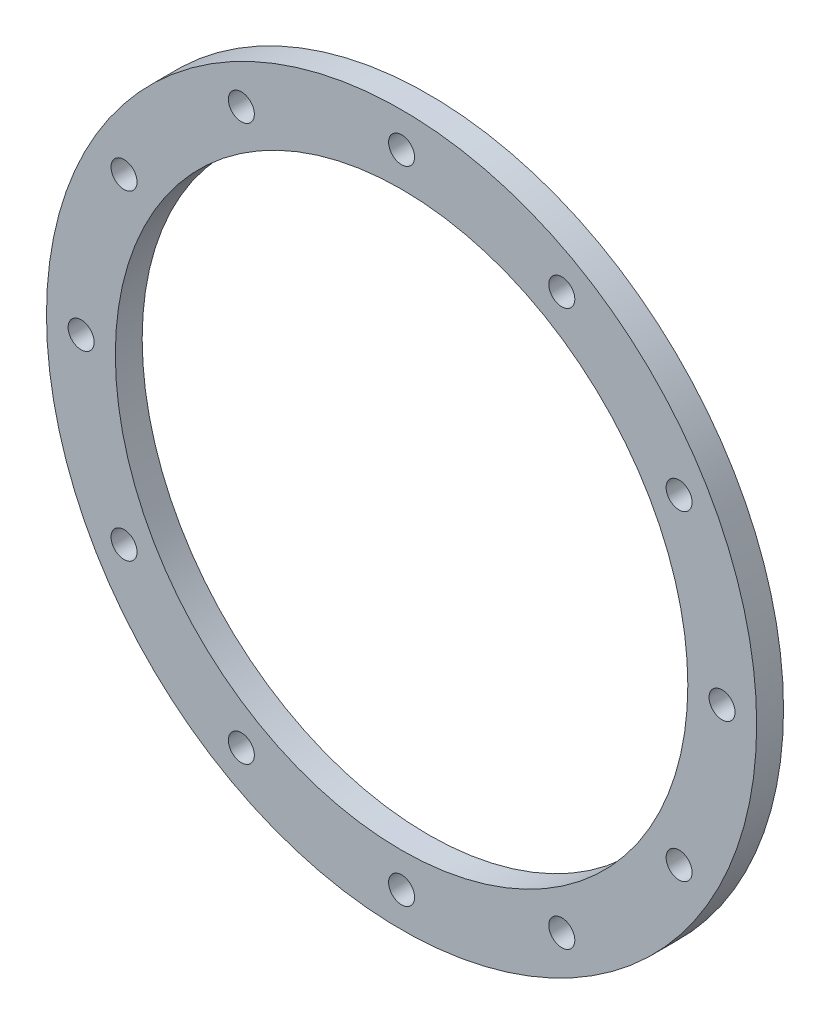
from build123d import *

# Parameters (mm, degrees)
SKETCH_1_R      = 41
SKETCH_1_R_2    = 33.05
SKETCH_1_R_3    = 1.5
EXTRUDE_1_DEPTH = 3.1


with BuildPart() as part:
    # 草图1 → 凸台-拉伸1 (new body)
    with BuildSketch(Plane.XY):
        with Locations(Location((0, 0, 0), (0, 0, 180))):
            Circle(SKETCH_1_R)
        with Locations(Location((0, 0, 0), (0, 0, 180))):
            Circle(SKETCH_1_R_2, mode=Mode.SUBTRACT)
        with Locations(Location((0, 37, 0), (0, 0, 180))):
            Circle(SKETCH_1_R_3, mode=Mode.SUBTRACT)
        with Locations(Location((18.5, 32.04293994, 0), (0, 0, 180))):
            Circle(SKETCH_1_R_3, mode=Mode.SUBTRACT)
        with Locations(Location((32.04293994, 18.5, 0), (0, 0, 180))):
            Circle(SKETCH_1_R_3, mode=Mode.SUBTRACT)
        with Locations(Location((37, 0, 0), (0, 0, 180))):
            Circle(SKETCH_1_R_3, mode=Mode.SUBTRACT)
        with Locations(Location((32.04293994, -18.5, 0), (0, 0, 180))):
            Circle(SKETCH_1_R_3, mode=Mode.SUBTRACT)
        with Locations(Location((18.5, -32.04293994, 0), (0, 0, 180))):
            Circle(SKETCH_1_R_3, mode=Mode.SUBTRACT)
        with Locations(Location((0, -37, 0), (0, 0, 180))):
            Circle(SKETCH_1_R_3, mode=Mode.SUBTRACT)
        with Locations(Location((-18.5, -32.04293994, 0), (0, 0, 180))):
            Circle(SKETCH_1_R_3, mode=Mode.SUBTRACT)
        with Locations(Location((-32.04293994, -18.5, 0), (0, 0, 180))):
            Circle(SKETCH_1_R_3, mode=Mode.SUBTRACT)
        with Locations(Location((-37, 0, 0), (0, 0, 180))):
            Circle(SKETCH_1_R_3, mode=Mode.SUBTRACT)
        with Locations(Location((-32.04293994, 18.5, 0), (0, 0, 180))):
            Circle(SKETCH_1_R_3, mode=Mode.SUBTRACT)
        with Locations(Location((-18.5, 32.04293994, 0), (0, 0, 180))):
            Circle(SKETCH_1_R_3, mode=Mode.SUBTRACT)
    extrude(amount=EXTRUDE_1_DEPTH)


solid = part.part
